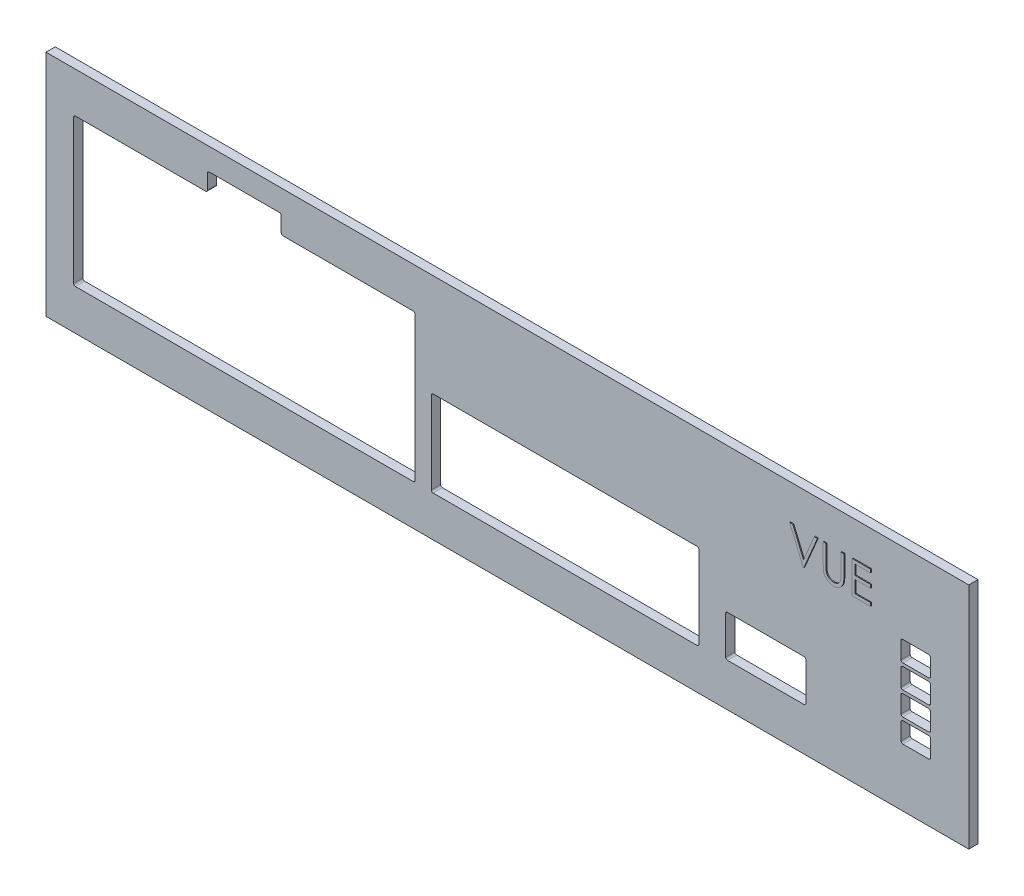
from build123d import *

# Parameters (mm, degrees)
ESQUISSE1_W             = 100
ESQUISSE1_H             = 24.8
BOSS_EXTRU_1_DEPTH      = 1
ESQUISSE2_W             = 29
ESQUISSE2_H             = 9.3
ESQUISSE2_W_2           = 8.7
ESQUISSE2_H_2           = 4.5
ESQUISSE2_W_3           = 3.2
ESQUISSE2_H_3           = 2.2
ENL_V_MAT_EXTRU_1_DEPTH = 52.524363169
CONG_1_R                = 0.2
BOSS_EXTRU_2_DEPTH      = 0.1


with BuildPart() as part:
    # Esquisse1 → Boss.-Extru.1 (new body)
    with BuildSketch(Plane.XY):
        Rectangle(ESQUISSE1_W, ESQUISSE1_H)
    extrude(amount=BOSS_EXTRU_1_DEPTH)

    # Esquisse2 → Enlèv. mat.-Extru.1 (cut, through all)
    with BuildSketch(Plane.XY.offset(1)):
        Polygon((-47.0074, 8), (-32.5074, 8), (-32.5074, 10), (-24.5074, 10), (-24.5074, 8), (-10.0074, 8), (-10.0074, -8), (-47.0074, -8), align=None)
        with Locations((6.25, -3.35)):
            Rectangle(ESQUISSE2_W, ESQUISSE2_H)
        with Locations((28, -5.5)):
            Rectangle(ESQUISSE2_W_2, ESQUISSE2_H_2)
        with Locations((44.255985376, 2.61)):
            Rectangle(ESQUISSE2_W_3, ESQUISSE2_H_3)
        with Locations((44.255985376, 0.07)):
            Rectangle(ESQUISSE2_W_3, ESQUISSE2_H_3)
        with Locations((44.255985376, -2.47)):
            Rectangle(ESQUISSE2_W_3, ESQUISSE2_H_3)
        with Locations((44.255985376, -5.01)):
            Rectangle(ESQUISSE2_W_3, ESQUISSE2_H_3)
    extrude(amount=-ENL_V_MAT_EXTRU_1_DEPTH, mode=Mode.SUBTRACT)

    # Congé1
    cong_1_edges = [part.edges().sort_by_distance(p)[0] for p in [
        (45.855985376, -3.91, 0.5),
        (45.855985376, -6.11, 0.5),
        (42.655985376, -6.11, 0.5),
        (42.655985376, -3.91, 0.5),
        (-47.0074, -8, 0.5),
        (-47.0074, 8, 0.5),
        (-32.5074, 8, 0.5),
        (-32.5074, 10, 0.5),
        (-24.5074, 10, 0.5),
        (-24.5074, 8, 0.5),
        (-10.0074, 8, 0.5),
        (-10.0074, -8, 0.5),
        (-8.25, -8, 0.5),
        (-8.25, 1.3, 0.5),
        (20.75, 1.3, 0.5),
        (20.75, -8, 0.5),
        (23.65, -7.75, 0.5),
        (23.65, -3.25, 0.5),
        (32.35, -3.25, 0.5),
        (32.35, -7.75, 0.5),
        (45.855985376, 3.71, 0.5),
        (45.855985376, 1.51, 0.5),
        (42.655985376, 1.51, 0.5),
        (42.655985376, 3.71, 0.5),
        (45.855985376, 1.17, 0.5),
        (45.855985376, -1.03, 0.5),
        (42.655985376, -1.03, 0.5),
        (42.655985376, 1.17, 0.5),
        (45.855985376, -1.37, 0.5),
        (45.855985376, -3.57, 0.5),
        (42.655985376, -3.57, 0.5),
        (42.655985376, -1.37, 0.5),
    ]]
    fillet(cong_1_edges, radius=CONG_1_R)

    # Esquisse3 → Boss.-Extru.2 (add)
    with BuildSketch(Plane.XY.offset(1)):
        Polygon((30.691975839, 8.654898364), (31.028514301, 8.654898364), (32.195180967, 5.896685223), (33.361847634, 8.654898364), (33.698386096, 8.654898364), (32.217616865, 5.154898364), (32.17274507, 5.154898364), align=None)
        with BuildLine():
            Line((34.326591224, 8.654898364), (34.640693788, 8.654898364))
            Line((34.640693788, 8.654898364), (34.640693788, 6.557843075))
            add(Edge.make_bspline(
                [(34.640693788, 6.557843075), (34.640647044, 6.528162339), (34.640558339, 6.471838028), (34.641150853, 6.391669728), (34.642810222, 6.320397269), (34.643856381, 6.257745921), (34.646183715, 6.204003174), (34.648081761, 6.158877863), (34.650522318, 6.122583661), (34.653455436, 6.101402735), (34.654716224, 6.092298203)],
                knots=[0, 0, 0, 0, 1.528628734, 2.90083645, 4.128790002, 5.200304208, 6.127813768, 6.898992206, 7.526736466, 8, 8, 8, 8], degree=3))
            add(Edge.make_bspline(
                [(34.654716224, 6.092298203), (34.659893683, 6.05945144), (34.669956869, 5.995608711), (34.695603247, 5.904700429), (34.731420748, 5.822768971), (34.77386379, 5.74725768), (34.829796402, 5.68026832), (34.896799937, 5.618556667), (34.977977706, 5.564584862), (35.068238311, 5.51523405), (35.165523549, 5.475568968), (35.264934815, 5.445575604), (35.364977794, 5.427296704), (35.431953959, 5.425180165), (35.465213019, 5.424129133)],
                knots=[0, 0, 0, 0, 1.035780045, 2.013197591, 2.933192213, 3.817615948, 4.702609284, 5.640816605, 6.646850145, 7.73207398, 8.84249596, 9.914020372, 10.964143139, 12, 12, 12, 12], degree=3))
            add(Edge.make_bspline(
                [(35.465213019, 5.424129133), (35.493766759, 5.425202983), (35.550709321, 5.427344481), (35.635315752, 5.440605912), (35.71771586, 5.464506478), (35.79831654, 5.495346237), (35.873867525, 5.536093828), (35.944410967, 5.583164667), (36.007374901, 5.638375543), (36.064832899, 5.699475888), (36.114867835, 5.768415688), (36.158238976, 5.843693826), (36.193764906, 5.926443173), (36.211308431, 5.984597595), (36.220321192, 6.014473684)],
                knots=[0, 0, 0, 0, 0.994687771, 1.983630487, 2.973142513, 3.978332533, 4.983357753, 5.956394766, 6.925816176, 7.893390482, 8.871859704, 9.88551698, 10.913711441, 12, 12, 12, 12], degree=3))
            add(Edge.make_bspline(
                [(36.220321192, 6.014473684), (36.223321317, 6.026822258), (36.230006805, 6.054339859), (36.23625385, 6.100861149), (36.242760376, 6.155750513), (36.247274946, 6.219402326), (36.251676166, 6.291603299), (36.254309239, 6.372729556), (36.255526272, 6.462486517), (36.255888952, 6.525123679), (36.256078403, 6.557843075)],
                knots=[0, 0, 0, 0, 0.558680831, 1.244966039, 2.062412453, 2.990489873, 4.051219941, 5.244515665, 6.560634259, 8, 8, 8, 8], degree=3))
            Line((36.256078403, 6.557843075), (36.256078403, 8.654898364))
            Line((36.256078403, 8.654898364), (36.570180967, 8.654898364))
            Line((36.570180967, 8.654898364), (36.570180967, 6.541016152))
            add(Edge.make_bspline(
                [(36.570180967, 6.541016152), (36.569926847, 6.502917773), (36.569430916, 6.42856647), (36.565130339, 6.319615111), (36.558273339, 6.21626213), (36.548585251, 6.118493633), (36.535748248, 6.026659474), (36.521473028, 5.939954706), (36.503293495, 5.859001713), (36.482060093, 5.783169296), (36.457786545, 5.710983782), (36.426345397, 5.642475168), (36.390920897, 5.575560768), (36.348906244, 5.511252659), (36.301694862, 5.449266106), (36.248243181, 5.389977031), (36.19031902, 5.332437985), (36.12695946, 5.278124919), (36.059208935, 5.228316242), (35.987268977, 5.184518471), (35.911692208, 5.147494853), (35.832675082, 5.117018929), (35.750183879, 5.094104329), (35.664216519, 5.077029174), (35.574577326, 5.067326876), (35.513612669, 5.065884946), (35.482741064, 5.065154774)],
                knots=[0, 0, 0, 0, 1.316592851, 2.569410997, 3.76748051, 4.895814652, 5.963796859, 6.97159953, 7.931736103, 8.829262218, 9.692595152, 10.560224239, 11.431080259, 12.30701507, 13.211635791, 14.121146779, 15.063487852, 16.031507147, 17.00238618, 17.966455255, 18.938106653, 19.907068911, 20.888905087, 21.893141452, 22.933117798, 24, 24, 24, 24], degree=3))
            add(Edge.make_bspline(
                [(35.482741064, 5.065154774), (35.449071961, 5.065939539), (35.383013302, 5.067479246), (35.285675235, 5.076301996), (35.192361039, 5.09292039), (35.102085161, 5.114080334), (35.016076664, 5.143264071), (34.93318322, 5.177362196), (34.854824539, 5.219239456), (34.77972941, 5.265832849), (34.709904654, 5.318257488), (34.645807251, 5.375397662), (34.58733138, 5.436338039), (34.535462684, 5.501738405), (34.489341799, 5.571090112), (34.449611586, 5.644589352), (34.415498342, 5.722207668), (34.397891775, 5.776160868), (34.388991064, 5.803436024)],
                knots=[0, 0, 0, 0, 1.13879206, 2.234305948, 3.301075583, 4.341971843, 5.366689343, 6.369221514, 7.369726634, 8.367512178, 9.355451585, 10.318319045, 11.268648973, 12.207971039, 13.137398894, 14.081662264, 15.030215811, 16, 16, 16, 16], degree=3))
            add(Edge.make_bspline(
                [(34.388991064, 5.803436024), (34.383813905, 5.822068598), (34.372584534, 5.862483067), (34.360559236, 5.929369556), (34.350450155, 6.006384473), (34.340944597, 6.093533092), (34.335335639, 6.190882958), (34.3304182, 6.298391874), (34.326556581, 6.416189836), (34.326579353, 6.498244352), (34.326591224, 6.541016152)],
                knots=[0, 0, 0, 0, 0.625038921, 1.35572334, 2.194682327, 3.136881307, 4.189498639, 5.346923369, 6.617055217, 8, 8, 8, 8], degree=3))
            Line((34.326591224, 6.541016152), (34.326591224, 8.654898364))
        make_face()
        Polygon((37.467616865, 8.654898364), (39.441975839, 8.654898364), (39.441975839, 8.295924005), (37.781719429, 8.295924005), (37.781719429, 7.219000928), (39.441975839, 7.219000928), (39.441975839, 6.860026569), (37.781719429, 6.860026569), (37.781719429, 5.513872723), (39.441975839, 5.513872723), (39.441975839, 5.154898364), (37.467616865, 5.154898364), align=None)
    extrude(amount=BOSS_EXTRU_2_DEPTH)


solid = part.part
